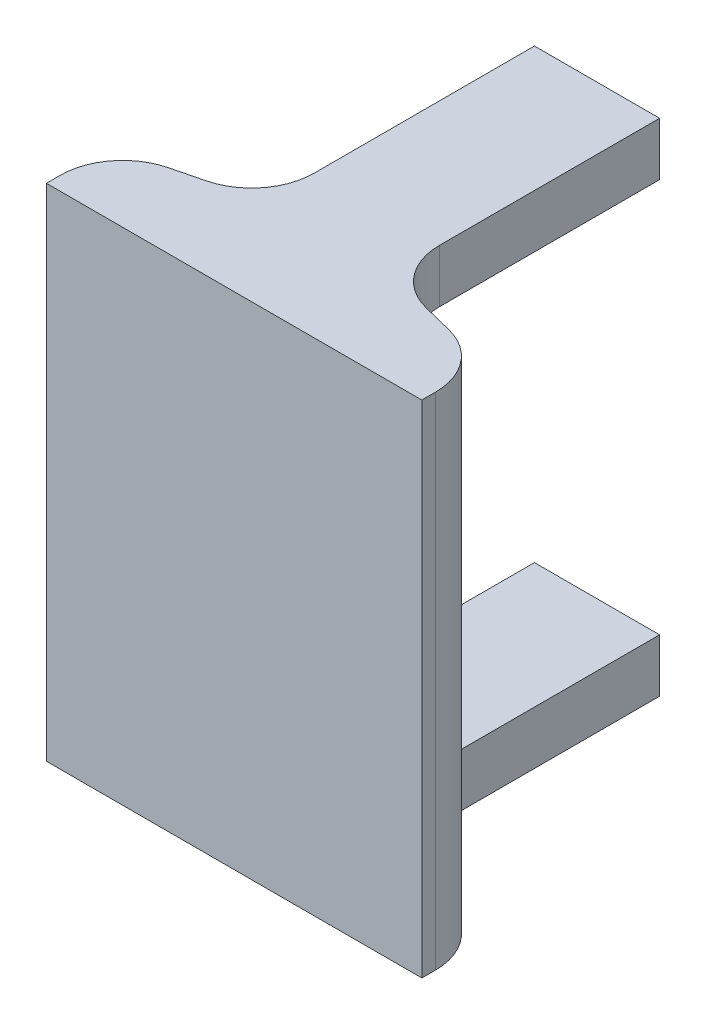
from build123d import *

# Parameters (mm, degrees)
BOSS_EXTRUDE1_DEPTH     = 80
CUT_EXTRUDE1_DEPTH      = 96.650405122
CUT_EXTRUDE1_DEPTH_BACK = 96.650405122


with BuildPart() as part:
    # Sketch1 → Boss-Extrude1 (new body)
    with BuildSketch(Plane(origin=(0, 0, 0), x_dir=(1, 0, 0), z_dir=(0, 1, 0))):
        with BuildLine():
            Line((0, -15), (-30, -15))
            Line((-30, -15), (-30, -12.807764064))
            ThreePointArc((-30, -12.807764064), (-27.88205438, -6.65364197), (-22.42535625, -3.106339063))
            Line((-22.42535625, -3.106339063), (-17.57464375, -1.893660937))
            ThreePointArc((-17.57464375, -1.893660937), (-12.11794562, 1.65364197), (-10, 7.807764064))
            Line((-10, 7.807764064), (-10, 43))
            Line((-10, 43), (0, 43))
            Line((0, 43), (10, 43))
            Line((10, 43), (10, 7.807764064))
            ThreePointArc((10, 7.807764064), (12.11794562, 1.65364197), (17.57464375, -1.893660937))
            Line((17.57464375, -1.893660937), (22.42535625, -3.106339063))
            ThreePointArc((22.42535625, -3.106339063), (27.88205438, -6.65364197), (30, -12.807764064))
            Line((30, -12.807764064), (30, -15))
            Line((30, -15), (0, -15))
        make_face()
    extrude(amount=BOSS_EXTRUDE1_DEPTH)

    # Sketch2 → Cut-Extrude1 (cut, two sides: drawn at the far end of the back side and taken through both)
    with BuildSketch(Plane(origin=(0, 0, 0), x_dir=(0, 0, -1), z_dir=(1, 0, 0)).offset(-CUT_EXTRUDE1_DEPTH_BACK)):
        Polygon((237.133104031, 8.5), (43, 8.5), (3, 8.5), (3, 71.5), (43, 71.5), (237.133104031, 71.5), (625.399312092, 71.5), (625.399312092, 8.5), align=None)
    extrude(amount=CUT_EXTRUDE1_DEPTH + CUT_EXTRUDE1_DEPTH_BACK, mode=Mode.SUBTRACT)


solid = part.part
